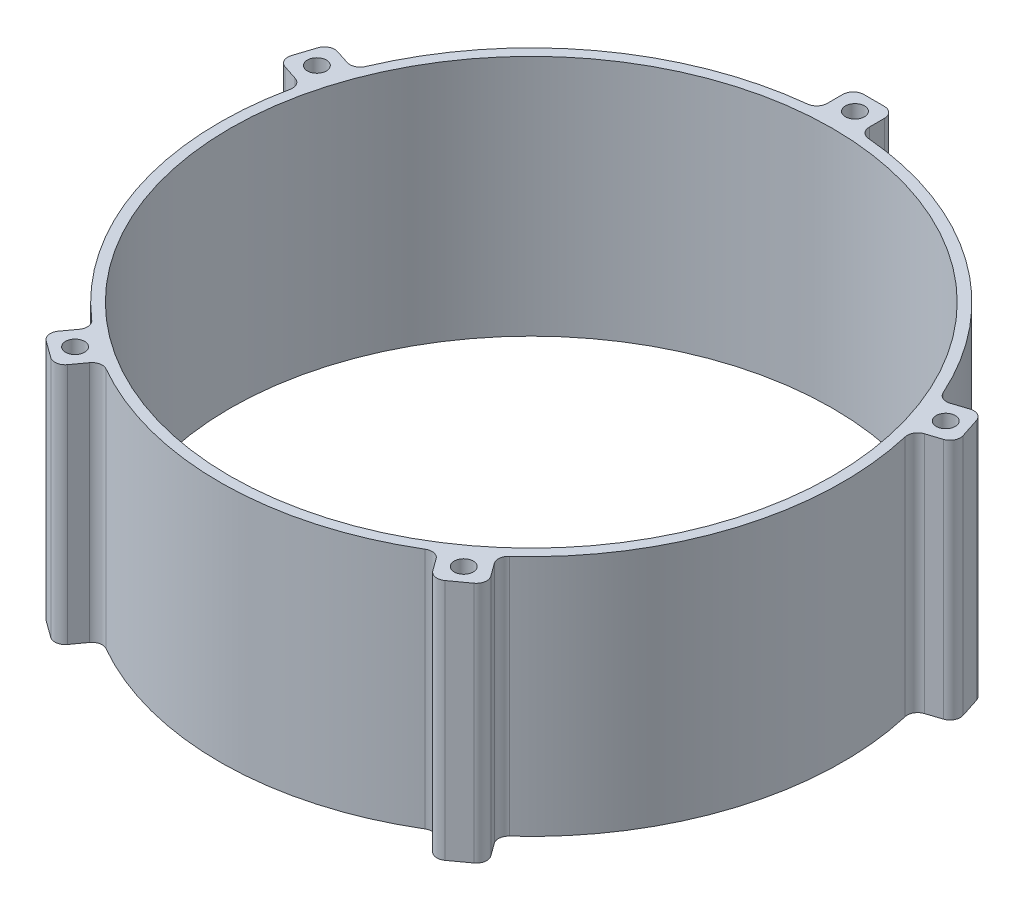
from build123d import *

# Parameters (mm, degrees)
SKETCH1_R           = 90
BOSS_EXTRUDE1_DEPTH = 70
SKETCH3_W           = 12
SKETCH3_H           = 12
BOSS_EXTRUDE2_DEPTH = 70
FILLET1_R           = 3
SKETCH2_R           = 87
CUT_EXTRUDE3_DEPTH  = 197.859070299
SKETCH5_R           = 2.75
CUT_EXTRUDE4_DEPTH  = 197.859070299


with BuildPart() as part:
    # Sketch1 → Boss-Extrude1 (new body)
    with BuildSketch(Plane(origin=(0, 0, 0), x_dir=(1, 0, 0), z_dir=(0, 1, 0))):
        with Locations(Location((46.842609329, -26.131207683, 0), (0, 0, 270))):
            Circle(SKETCH1_R)
    extrude(amount=BOSS_EXTRUDE1_DEPTH)

    # Sketch3 → Boss-Extrude2 (add)
    with BuildSketch(Plane(origin=(0, 70, 0), x_dir=(1, 0, 0), z_dir=(0, 1, 0))):
        Polygon((139.785141997, 11.427887368), (128.372463802, 7.719683436), (132.080667734, -3.69299476), (143.49334593, 0.015209173), align=None)
        with Locations((45.842609329, 67.868792317)):
            Rectangle(SKETCH3_W, SKETCH3_H)
        Polygon((111.284253518, -102.918410355), (104.230830491, -93.210206422), (94.522626558, -100.26362945), (101.576049586, -109.971833382), align=None)
        Polygon((-6.27279694, -111.147403887), (0.780626087, -101.439199954), (-8.927577845, -94.385776927), (-15.981000873, -104.093980859), align=None)
        Polygon((-50.426161262, -1.88690386), (-39.013483066, -5.595107792), (-35.305279134, 5.817570403), (-46.717957329, 9.525774336), align=None)
    extrude(amount=-BOSS_EXTRUDE2_DEPTH)

    # Fillet1
    fillet1_edges = [part.edges().sort_by_distance(p)[0] for p in [
        (51.842609329, 35, -73.868792317),
        (39.842609329, 35, -63.59615715),
        (39.842609329, 35, -73.868792317),
        (51.842609329, 35, -63.729796095),
        (143.49334593, 35, -0.015209173),
        (139.785141997, 35, -11.427887368),
        (133.850587504, 35, 3.117912966),
        (130.015285383, 35, -8.253468525),
        (101.576049586, 35, 109.971833382),
        (111.284253518, 35, 102.918410355),
        (95.616497134, 35, 101.769213133),
        (105.246150065, 35, 94.607673928),
        (-15.981000873, 35, 104.093980859),
        (-6.27279694, 35, 111.147403887),
        (-10.02144842, 35, 95.89136061),
        (-0.234693487, 35, 102.83666746),
        (-46.717957329, 35, -9.525774336),
        (-50.426161262, 35, 1.88690386),
        (-37.075198904, 35, -6.392652197),
        (-40.656304647, 35, 5.061322703),
    ]]
    fillet(fillet1_edges, radius=FILLET1_R)

    # Sketch2 → Cut-Extrude3 (cut, through all)
    with BuildSketch(Plane(origin=(0, 70, 0), x_dir=(1, 0, 0), z_dir=(0, 1, 0))):
        with Locations(Location((46.842609329, -26.131207683, 0), (0, 0, 270))):
            Circle(SKETCH2_R)
    extrude(amount=-CUT_EXTRUDE3_DEPTH, mode=Mode.SUBTRACT)

    # Sketch5 → Cut-Extrude4 (cut, through all)
    with BuildSketch(Plane(origin=(0, 70, 0), x_dir=(1, 0, 0), z_dir=(0, 1, 0))):
        with Locations(Location((103.197332665, -101.995528399, 0), (0, 0, 270))):
            Circle(SKETCH5_R)
        with Locations(Location((-7.894080019, -103.171098904, 0), (0, 0, 270))):
            Circle(SKETCH5_R)
        with Locations(Location((-43.341248456, 2.119841769, 0), (0, 0, 270))):
            Circle(SKETCH5_R)
        with Locations(Location((45.842609329, 68.368792317, 0), (0, 0, 270))):
            Circle(SKETCH5_R)
        with Locations(Location((136.408433124, 4.021954801, 0), (0, 0, 270))):
            Circle(SKETCH5_R)
    extrude(amount=-CUT_EXTRUDE4_DEPTH, mode=Mode.SUBTRACT)


solid = part.part
